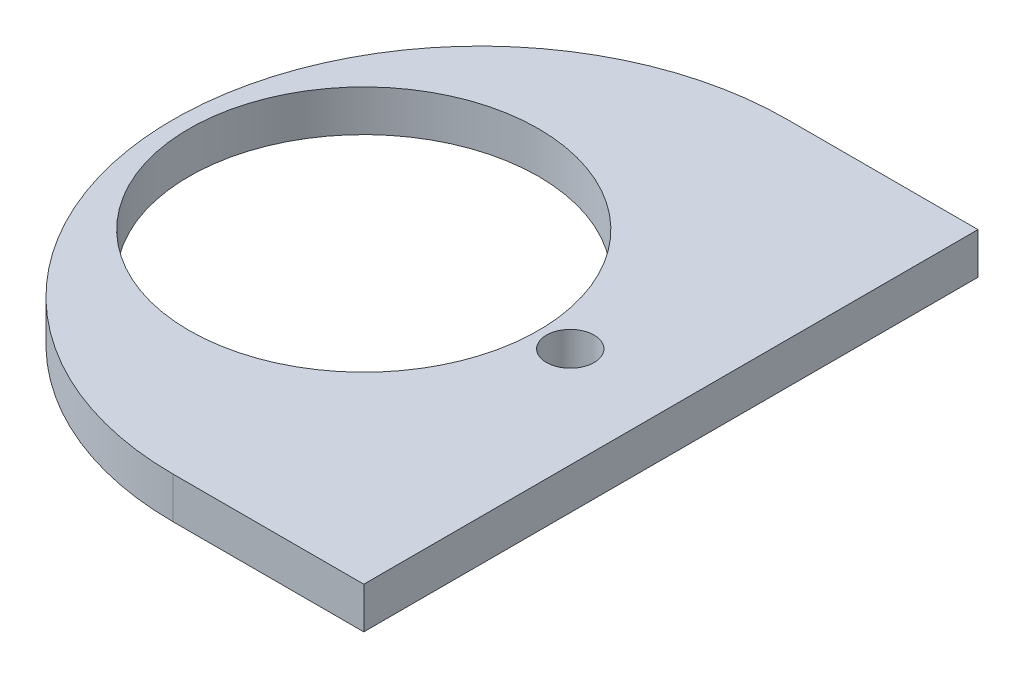
from build123d import *

# Parameters (mm, degrees)
SKETCH1_R           = 33
SKETCH1_R_2         = 4.5
BOSS_EXTRUDE1_DEPTH = 7.8


with BuildPart() as part:
    # Sketch1 → Boss-Extrude1 (new body)
    with BuildSketch(Plane(origin=(0, 0, 0), x_dir=(1, 0, 0), z_dir=(0, 1, 0))):
        with BuildLine():
            Line((0, 0), (36, 0))
            Line((36, 0), (36, -116))
            Line((36, -116), (0, -116))
            ThreePointArc((0, -116), (-58, -58), (0, 0))
        make_face()
        with Locations(Location((-22, -58, 0), (0, 0, 270))):
            Circle(SKETCH1_R, mode=Mode.SUBTRACT)
        with Locations(Location((17, -58, 0), (0, 0, 270))):
            Circle(SKETCH1_R_2, mode=Mode.SUBTRACT)
    extrude(amount=BOSS_EXTRUDE1_DEPTH)


solid = part.part
